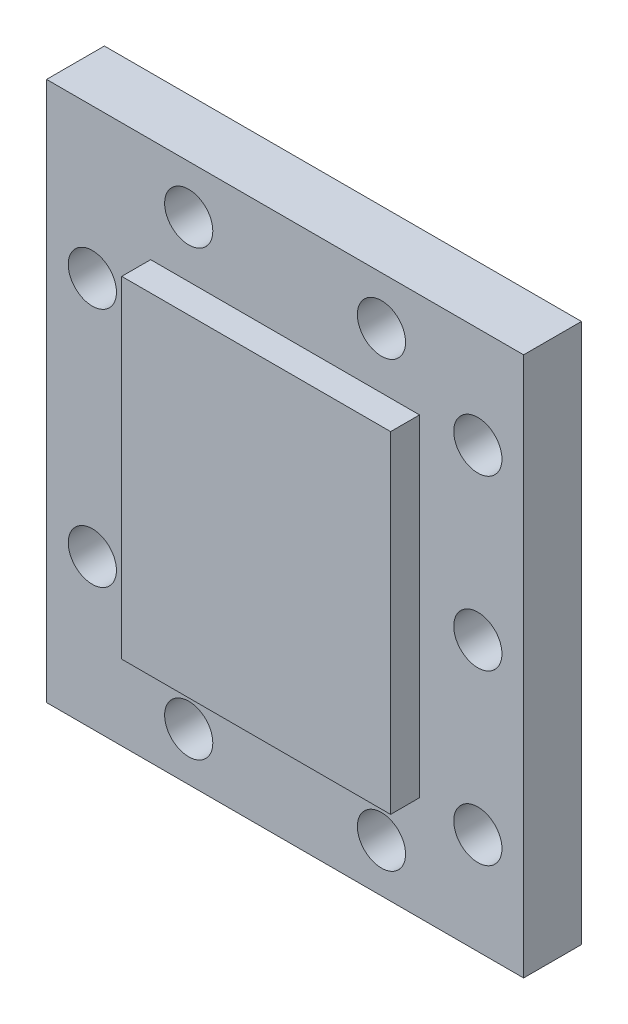
from build123d import *

# Parameters (mm, degrees)
SKETCH1_W               = 62.865
SKETCH1_H               = 71.12
BOSS_EXTRUDE1_DEPTH     = 7.62
SKETCH2_W               = 35.433
SKETCH2_H               = 43.688
BOSS_EXTRUDE2_DEPTH     = 3.81
SKETCH3_W               = 35.433
SKETCH3_H               = 43.688
CUT_EXTRUDE1_DEPTH      = 3.175
CUT_EXTRUDE2_DEPTH      = 49.068493384
CUT_EXTRUDE2_DEPTH_BACK = 49.068493384
SKETCH4_R               = 3.175


with BuildPart() as part:
    # Sketch1 → Boss-Extrude1 (new body)
    with BuildSketch(Plane.XY):
        Rectangle(SKETCH1_W, SKETCH1_H)
    extrude(amount=BOSS_EXTRUDE1_DEPTH)

    # Sketch2 → Boss-Extrude2 (add)
    with BuildSketch(Plane.XY.offset(7.62)):
        Rectangle(SKETCH2_W, SKETCH2_H)
    extrude(amount=BOSS_EXTRUDE2_DEPTH)

    # Sketch3 → Cut-Extrude1 (cut)
    with BuildSketch(Plane(origin=(0, 0, 0), x_dir=(-1, 0, 0), z_dir=(0, 0, -1))):
        Rectangle(SKETCH3_W, SKETCH3_H)
    extrude(amount=-CUT_EXTRUDE1_DEPTH, mode=Mode.SUBTRACT)

    # Sketch4 → Cut-Extrude2 (cut, two sides: drawn at the far end of the back side and taken through both)
    with BuildSketch(Plane.XY.offset(7.62).offset(-CUT_EXTRUDE2_DEPTH_BACK)):
        with Locations((-12.7, 29.21)):
            Circle(SKETCH4_R)
        with Locations((-25.4, 15.875)):
            Circle(SKETCH4_R)
        with Locations((-12.7, -29.21)):
            Circle(SKETCH4_R)
        with Locations((-25.4, -15.875)):
            Circle(SKETCH4_R)
        with Locations((12.7, -29.21)):
            Circle(SKETCH4_R)
        with Locations((12.7, 29.21)):
            Circle(SKETCH4_R)
        with Locations((25.4, 0)):
            Circle(SKETCH4_R)
        with Locations((25.4, 22.225)):
            Circle(SKETCH4_R)
        with Locations((25.4, -22.225)):
            Circle(SKETCH4_R)
    extrude(amount=CUT_EXTRUDE2_DEPTH + CUT_EXTRUDE2_DEPTH_BACK, mode=Mode.SUBTRACT)


solid = part.part
